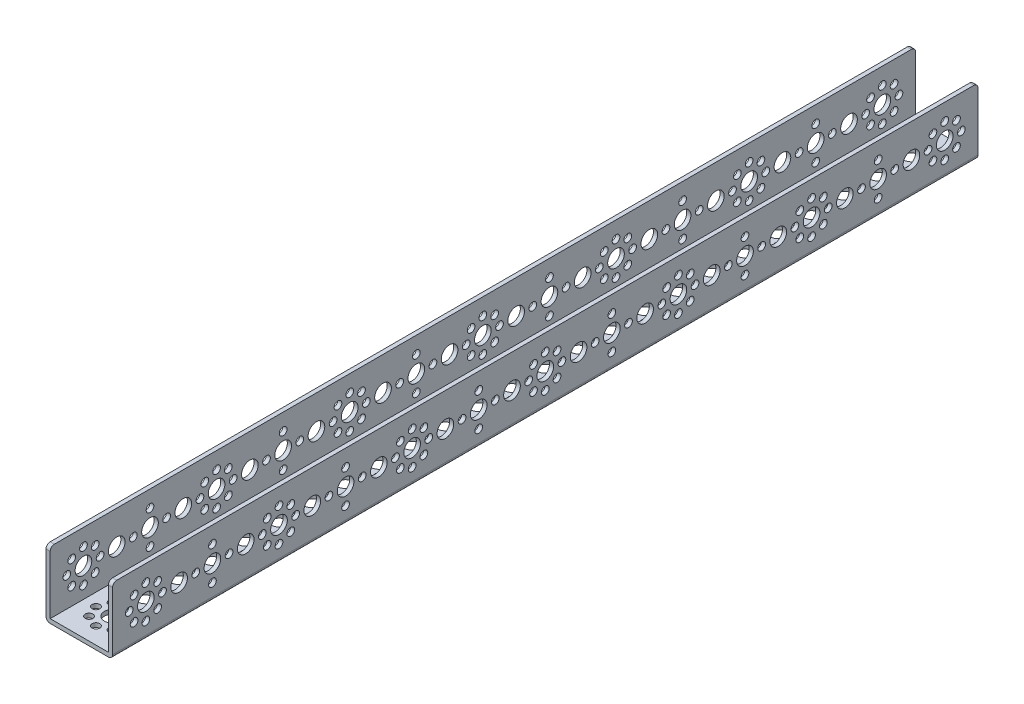
from build123d import *

# Parameters (mm, degrees)
BOSS_EXTRUDE1_DEPTH = 208
SKETCH2_R           = 4
SKETCH2_R_2         = 1.85
CUT_EXTRUDE1_DEPTH  = 213.86615513
SKETCH5_R           = 4
SKETCH5_R_2         = 1.85
CUT_EXTRUDE2_DEPTH  = 2
FILLET1_R           = 2


with BuildPart() as part:
    # Sketch1 → Boss-Extrude1 (new, symmetric)
    with BuildSketch(Plane.XY):
        with BuildLine():
            Line((-14, 0), (14, 0))
            ThreePointArc((14, 0), (15.414213562, 0.585786438), (16, 2))
            Line((16, 2), (16, 32))
            Line((16, 32), (14, 32))
            Line((14, 32), (14, 2))
            Line((14, 2), (-14, 2))
            Line((-14, 2), (-14, 32))
            Line((-14, 32), (-16, 32))
            Line((-16, 32), (-16, 2))
            ThreePointArc((-16, 2), (-15.414213562, 0.585786438), (-14, 0))
        make_face()
    extrude(amount=BOSS_EXTRUDE1_DEPTH, both=True)

    # Sketch2 → Cut-Extrude1 (cut, through all)
    with BuildSketch(Plane(origin=(16, 0, 0), x_dir=(0, 0, -1), z_dir=(1, 0, 0))):
        with Locations((-160, 16)):
            Circle(SKETCH2_R)
        with Locations((-152, 16)):
            Circle(SKETCH2_R_2)
        with Locations((-168, 16)):
            Circle(SKETCH2_R_2)
        with Locations((-160, 8)):
            Circle(SKETCH2_R_2)
        with Locations((-160, 24)):
            Circle(SKETCH2_R_2)
        with Locations((-176, 16)):
            Circle(SKETCH2_R)
        with Locations((-144, 16)):
            Circle(SKETCH2_R)
        with Locations((-112, 16)):
            Circle(SKETCH2_R)
        with Locations((-80, 16)):
            Circle(SKETCH2_R)
        with Locations((-186.343145751, 21.656854249)):
            Circle(SKETCH2_R_2)
        with Locations((-192, 24)):
            Circle(SKETCH2_R_2)
        with Locations((-197.656854249, 21.656854249)):
            Circle(SKETCH2_R_2)
        with Locations((-192, 16)):
            Circle(SKETCH2_R)
        with Locations((-184, 16)):
            Circle(SKETCH2_R_2)
        with Locations((-200, 16)):
            Circle(SKETCH2_R_2)
        with Locations((-192, 8)):
            Circle(SKETCH2_R_2)
        with Locations((-186.343145751, 10.343145751)):
            Circle(SKETCH2_R_2)
        with Locations((-197.656854249, 10.343145751)):
            Circle(SKETCH2_R_2)
        with Locations((-96, 16)):
            Circle(SKETCH2_R)
        with Locations((-88, 16)):
            Circle(SKETCH2_R_2)
        with Locations((-104, 16)):
            Circle(SKETCH2_R_2)
        with Locations((-96, 8)):
            Circle(SKETCH2_R_2)
        with Locations((-96, 24)):
            Circle(SKETCH2_R_2)
        with Locations((-128, 16)):
            Circle(SKETCH2_R)
        with Locations((-120, 16)):
            Circle(SKETCH2_R_2)
        with Locations((-136, 16)):
            Circle(SKETCH2_R_2)
        with Locations((-128, 8)):
            Circle(SKETCH2_R_2)
        with Locations((-128, 24)):
            Circle(SKETCH2_R_2)
        with Locations((-133.656854249, 21.656854249)):
            Circle(SKETCH2_R_2)
        with Locations((-122.343145751, 21.656854249)):
            Circle(SKETCH2_R_2)
        with Locations((-122.343145751, 10.343145751)):
            Circle(SKETCH2_R_2)
        with Locations((-133.656854249, 10.343145751)):
            Circle(SKETCH2_R_2)
        with Locations((-48, 16)):
            Circle(SKETCH2_R)
        with Locations((-56, 16)):
            Circle(SKETCH2_R_2)
        with Locations((-64, 8)):
            Circle(SKETCH2_R_2)
        with Locations((-64, 16)):
            Circle(SKETCH2_R)
        with Locations((-64, 24)):
            Circle(SKETCH2_R_2)
        with Locations((-69.656854249, 21.656854249)):
            Circle(SKETCH2_R_2)
        with Locations((-69.656854249, 10.343145751)):
            Circle(SKETCH2_R_2)
        with Locations((-72, 16)):
            Circle(SKETCH2_R_2)
        with Locations((-58.343145751, 21.656854249)):
            Circle(SKETCH2_R_2)
        with Locations((-58.343145751, 10.343145751)):
            Circle(SKETCH2_R_2)
        with Locations((8, 16)):
            Circle(SKETCH2_R_2)
        with Locations((0, 8)):
            Circle(SKETCH2_R_2)
        with Locations((0, 16)):
            Circle(SKETCH2_R)
        with Locations((0, 24)):
            Circle(SKETCH2_R_2)
        with Locations((-5.656854249, 21.656854249)):
            Circle(SKETCH2_R_2)
        with Locations((-5.656854249, 10.343145751)):
            Circle(SKETCH2_R_2)
        with Locations((-8, 16)):
            Circle(SKETCH2_R_2)
        with Locations((5.656854249, 21.656854249)):
            Circle(SKETCH2_R_2)
        with Locations((5.656854249, 10.343145751)):
            Circle(SKETCH2_R_2)
        with Locations((-32, 16)):
            Circle(SKETCH2_R)
        with Locations((-24, 16)):
            Circle(SKETCH2_R_2)
        with Locations((-40, 16)):
            Circle(SKETCH2_R_2)
        with Locations((-32, 8)):
            Circle(SKETCH2_R_2)
        with Locations((-32, 24)):
            Circle(SKETCH2_R_2)
        with Locations((-16, 16)):
            Circle(SKETCH2_R)
    cut_extrude1 = extrude(amount=-CUT_EXTRUDE1_DEPTH, mode=Mode.SUBTRACT)

    # Sketch5 → Cut-Extrude2 (cut)
    with BuildSketch(Plane.XZ):
        with Locations(Location((0, 16, 0), (0, 0, 270))):
            Circle(SKETCH5_R)
        with Locations(Location((0, 48, 0), (0, 0, 270))):
            Circle(SKETCH5_R)
        with Locations(Location((0, 80, 0), (0, 0, 270))):
            Circle(SKETCH5_R)
        with Locations(Location((0, 112, 0), (0, 0, 270))):
            Circle(SKETCH5_R)
        with Locations(Location((0, 144, 0), (0, 0, 270))):
            Circle(SKETCH5_R)
        with Locations(Location((0, 176, 0), (0, 0, 270))):
            Circle(SKETCH5_R)
        with Locations(Location((0, 160.000000057, 0), (0, 0, 270))):
            Circle(SKETCH5_R)
        with Locations(Location((0, 152.000000057, 0), (0, 0, 270))):
            Circle(SKETCH5_R_2)
        with Locations(Location((0, 168.000000057, 0), (0, 0, 270))):
            Circle(SKETCH5_R_2)
        with Locations(Location((-8, 160.000000057, 0), (0, 0, 270))):
            Circle(SKETCH5_R_2)
        with Locations(Location((8, 160.000000057, 0), (0, 0, 270))):
            Circle(SKETCH5_R_2)
        with Locations(Location((0, 184, 0), (0, 0, 270))):
            Circle(SKETCH5_R_2)
        with Locations(Location((-8, 192, 0), (0, 0, 270))):
            Circle(SKETCH5_R_2)
        with Locations(Location((0, 192, 0), (0, 0, 270))):
            Circle(SKETCH5_R)
        with Locations(Location((8, 192, 0), (0, 0, 270))):
            Circle(SKETCH5_R_2)
        with Locations(Location((5.656854249, 197.656854249, 0), (0, 0, 270))):
            Circle(SKETCH5_R_2)
        with Locations(Location((-5.656854249, 197.656854249, 0), (0, 0, 270))):
            Circle(SKETCH5_R_2)
        with Locations(Location((0, 200, 0), (0, 0, 270))):
            Circle(SKETCH5_R_2)
        with Locations(Location((5.656854249, 186.343145751, 0), (0, 0, 270))):
            Circle(SKETCH5_R_2)
        with Locations(Location((-5.656854249, 186.343145751, 0), (0, 0, 270))):
            Circle(SKETCH5_R_2)
        with Locations(Location((0, 96.000000171, 0), (0, 0, 270))):
            Circle(SKETCH5_R)
        with Locations(Location((0, 88.000000171, 0), (0, 0, 270))):
            Circle(SKETCH5_R_2)
        with Locations(Location((0, 104.000000171, 0), (0, 0, 270))):
            Circle(SKETCH5_R_2)
        with Locations(Location((-8, 96.000000171, 0), (0, 0, 270))):
            Circle(SKETCH5_R_2)
        with Locations(Location((8, 96.000000171, 0), (0, 0, 270))):
            Circle(SKETCH5_R_2)
        with Locations(Location((0, 120.000000114, 0), (0, 0, 270))):
            Circle(SKETCH5_R_2)
        with Locations(Location((-8, 128.000000114, 0), (0, 0, 270))):
            Circle(SKETCH5_R_2)
        with Locations(Location((0, 128.000000114, 0), (0, 0, 270))):
            Circle(SKETCH5_R)
        with Locations(Location((8, 128.000000114, 0), (0, 0, 270))):
            Circle(SKETCH5_R_2)
        with Locations(Location((5.656854249, 133.656854364, 0), (0, 0, 270))):
            Circle(SKETCH5_R_2)
        with Locations(Location((-5.656854249, 133.656854364, 0), (0, 0, 270))):
            Circle(SKETCH5_R_2)
        with Locations(Location((0, 136.000000114, 0), (0, 0, 270))):
            Circle(SKETCH5_R_2)
        with Locations(Location((5.656854249, 122.343145865, 0), (0, 0, 270))):
            Circle(SKETCH5_R_2)
        with Locations(Location((-5.656854249, 122.343145865, 0), (0, 0, 270))):
            Circle(SKETCH5_R_2)
        with Locations(Location((0, 56.000000229, 0), (0, 0, 270))):
            Circle(SKETCH5_R_2)
        with Locations(Location((-8, 64.000000229, 0), (0, 0, 270))):
            Circle(SKETCH5_R_2)
        with Locations(Location((0, 64.000000229, 0), (0, 0, 270))):
            Circle(SKETCH5_R)
        with Locations(Location((8, 64.000000229, 0), (0, 0, 270))):
            Circle(SKETCH5_R_2)
        with Locations(Location((5.656854249, 69.656854478, 0), (0, 0, 270))):
            Circle(SKETCH5_R_2)
        with Locations(Location((-5.656854249, 69.656854478, 0), (0, 0, 270))):
            Circle(SKETCH5_R_2)
        with Locations(Location((0, 72.000000229, 0), (0, 0, 270))):
            Circle(SKETCH5_R_2)
        with Locations(Location((5.656854249, 58.343145979, 0), (0, 0, 270))):
            Circle(SKETCH5_R_2)
        with Locations(Location((-5.656854249, 58.343145979, 0), (0, 0, 270))):
            Circle(SKETCH5_R_2)
        with Locations(Location((0, -8, 0), (0, 0, 270))):
            Circle(SKETCH5_R_2)
        with Locations(Location((-8, 0, 0), (0, 0, 270))):
            Circle(SKETCH5_R_2)
        with Locations(Location((0, 0, 0), (0, 0, 270))):
            Circle(SKETCH5_R)
        with Locations(Location((8, 0, 0), (0, 0, 270))):
            Circle(SKETCH5_R_2)
        with Locations(Location((5.656854249, 5.656854249, 0), (0, 0, 270))):
            Circle(SKETCH5_R_2)
        with Locations(Location((-5.656854249, 5.656854249, 0), (0, 0, 270))):
            Circle(SKETCH5_R_2)
        with Locations(Location((0, 8, 0), (0, 0, 270))):
            Circle(SKETCH5_R_2)
        with Locations(Location((5.656854249, -5.656854249, 0), (0, 0, 270))):
            Circle(SKETCH5_R_2)
        with Locations(Location((-5.656854249, -5.656854249, 0), (0, 0, 270))):
            Circle(SKETCH5_R_2)
        with Locations(Location((0, 32.000000286, 0), (0, 0, 270))):
            Circle(SKETCH5_R)
        with Locations(Location((0, 24.000000286, 0), (0, 0, 270))):
            Circle(SKETCH5_R_2)
        with Locations(Location((0, 40.000000286, 0), (0, 0, 270))):
            Circle(SKETCH5_R_2)
        with Locations(Location((-8, 32.000000286, 0), (0, 0, 270))):
            Circle(SKETCH5_R_2)
        with Locations(Location((8, 32.000000286, 0), (0, 0, 270))):
            Circle(SKETCH5_R_2)
    cut_extrude2 = extrude(amount=-CUT_EXTRUDE2_DEPTH, mode=Mode.SUBTRACT)

    # Fillet1
    fillet1_edges = [part.edges().sort_by_distance(p)[0] for p in [
        (15, 32, 208),
        (15, 32, -208),
        (-15, 32, -208),
        (-15, 32, 208),
    ]]
    fillet(fillet1_edges, radius=FILLET1_R)

    # Mirror1: Cut-Extrude1, Cut-Extrude2 across plane
    add(cut_extrude1.mirror(Plane.XY), mode=Mode.SUBTRACT)
    add(cut_extrude2.mirror(Plane.XY), mode=Mode.SUBTRACT)


solid = part.part
